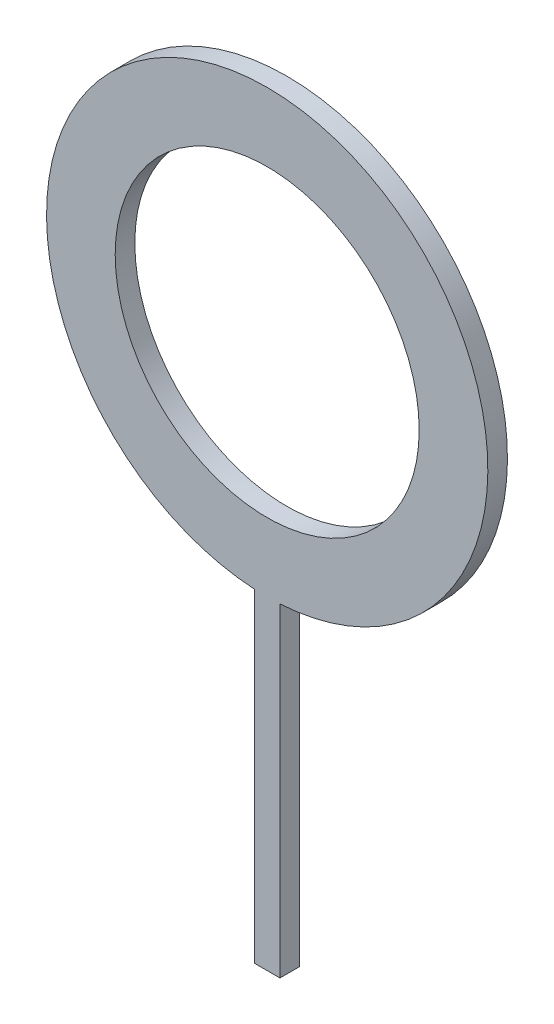
from build123d import *

# Parameters (mm, degrees)
BOSS_EXTRUDE1_DEPTH = 1


with BuildPart() as part:
    # Sketch1 → Boss-Extrude1 (new body)
    # profile 1 of 5: a face of its own
    with BuildSketch(Plane.XY):
        with BuildLine():
            Line((-0.65, -7.75), (0, -7.75))
            Line((0, -7.75), (0.65, -7.75))
            Line((0.65, -7.75), (0.65, -11.231206525))
            ThreePointArc((0.65, -11.231206525), (8.181534086, -7.721722606), (11.25, 0))
            ThreePointArc((11.25, 0), (-7.721722606, 8.181534086), (-0.65, -11.231206525))
            Line((-0.65, -11.231206525), (-0.65, -7.75))
        make_face()
        with BuildLine():
            ThreePointArc((7.75, 0), (5.480077554, -5.480077554), (0, -7.75))
            ThreePointArc((0, -7.75), (-5.480077554, 5.480077554), (7.75, 0))
        make_face(mode=Mode.SUBTRACT)
    # profile 2 of 5: a face of its own
    with BuildSketch(Plane.XY):
        with BuildLine():
            Line((0.65, -7.75), (0, -7.75))
            Line((0, -7.75), (0, -11.25))
            ThreePointArc((0, -11.25), (0.325135816, -11.24530065), (0.65, -11.231206525))
            Line((0.65, -11.231206525), (0.65, -7.75))
        make_face()
    # profile 3 of 5: a face of its own
    with BuildSketch(Plane.XY):
        with BuildLine():
            Line((0, -11.25), (0, -7.75))
            Line((0, -7.75), (-0.65, -7.75))
            Line((-0.65, -7.75), (-0.65, -11.231206525))
            ThreePointArc((-0.65, -11.231206525), (-0.325135816, -11.24530065), (0, -11.25))
        make_face()
    # profile 4 of 5: a face of its own
    with BuildSketch(Plane.XY):
        with BuildLine():
            Line((0, -27.75), (0, -11.25))
            ThreePointArc((0, -11.25), (-0.325135816, -11.24530065), (-0.65, -11.231206525))
            Line((-0.65, -11.231206525), (-0.65, -27.75))
            Line((-0.65, -27.75), (0, -27.75))
        make_face()
    # profile 5 of 5: a face of its own
    with BuildSketch(Plane.XY):
        with BuildLine():
            ThreePointArc((0.65, -11.231206525), (0.325135816, -11.24530065), (0, -11.25))
            Line((0, -11.25), (0, -27.75))
            Line((0, -27.75), (0.65, -27.75))
            Line((0.65, -27.75), (0.65, -11.231206525))
        make_face()
    extrude(amount=BOSS_EXTRUDE1_DEPTH)


solid = part.part
